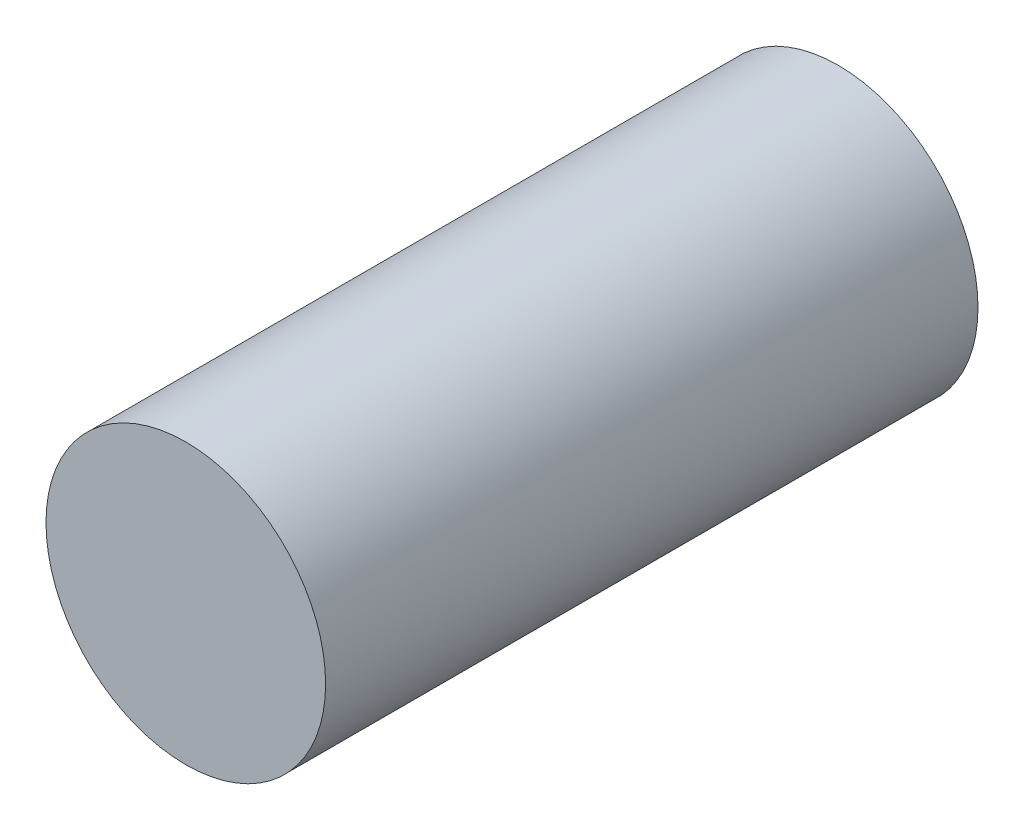
from build123d import *

# Parameters (mm, degrees)
SKETCH1_R           = 7.5
BOSS_EXTRUDE1_DEPTH = 35


with BuildPart() as part:
    # Sketch1 → Boss-Extrude1 (new body)
    with BuildSketch(Plane.XY):
        Circle(SKETCH1_R)
    extrude(amount=BOSS_EXTRUDE1_DEPTH)


solid = part.part
